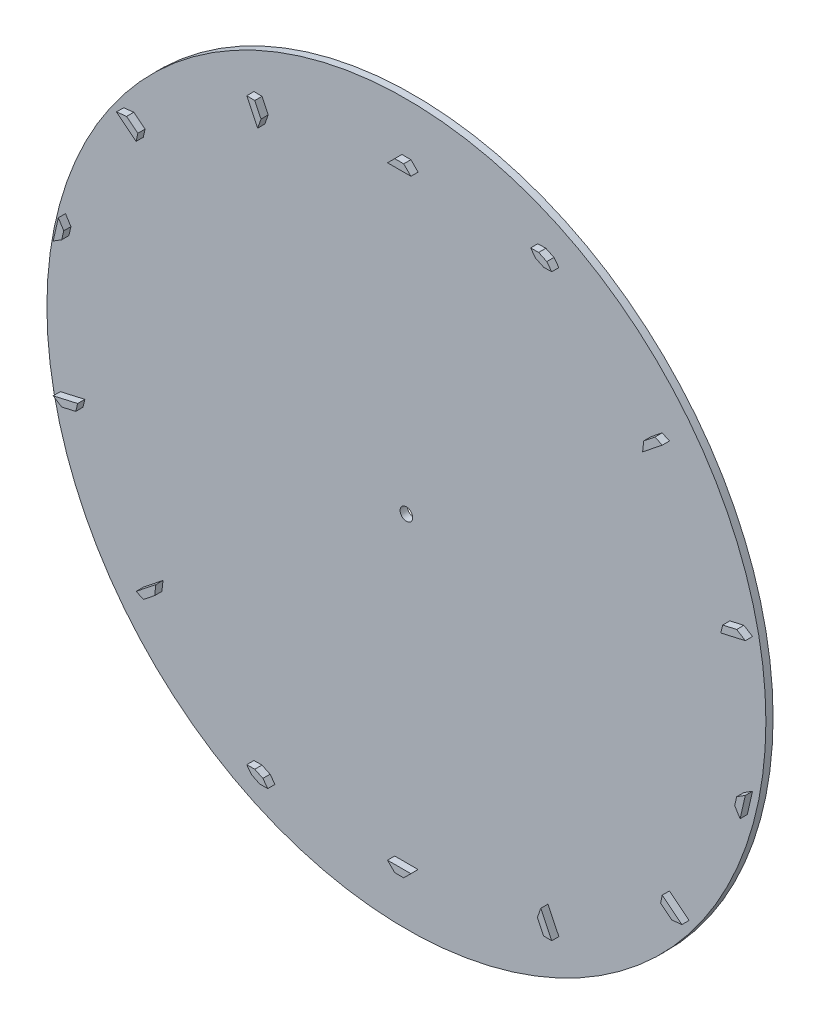
from build123d import *

# Parameters (mm, degrees)
SKETCH1_R           = 100
SKETCH1_R_2         = 1.75
BOSS_EXTRUDE1_DEPTH = 2
BOSS_EXTRUDE2_DEPTH = 2


with BuildPart() as part:
    # Sketch1 → Boss-Extrude1 (new body)
    with BuildSketch(Plane.XY):
        Circle(SKETCH1_R)
        Circle(SKETCH1_R_2, mode=Mode.SUBTRACT)
    extrude(amount=BOSS_EXTRUDE1_DEPTH)

    # Sketch2 → Boss-Extrude2 (add)
    with BuildSketch(Plane.XY.offset(2)):
        Polygon((-3.25, -84), (-1.25, -86), (1.25, -86), (3.25, -84), align=None)
        Polygon((-40.175747605, -80.544843437), (-42.41156908, -80.578044827), (-41.043515084, -82.346781173), (-38.791092914, -83.431490521), (-36.555271439, -83.398289131), (-37.923325436, -81.629552785), align=None)
        Polygon((-68.016869745, -52.642833607), (-67.700186383, -49.832191038), (-73.173006761, -54.196619651), (-71.144195674, -55.136792814), align=None)
        Polygon((-89.971519088, -19.253266034), (-89.441633044, -17.080889275), (-96.266128429, -18.638535813), (-93.871230737, -20.14334977), align=None)
        Polygon((-93.314928402, 22.58066955), (-94.819742358, 24.975567242), (-96.266128429, 18.638535813), (-93.871230737, 20.14334977), align=None)
        Polygon((-78.645827138, 58.561048264), (-73.173006761, 54.196619651), (-72.707858639, 56.383772418), (-75.835184569, 58.877731625), align=None)
        Polygon((-42.41156908, 80.578044827), (-39.374382907, 74.271262752), (-38.440212649, 76.940967966), (-40.175747605, 80.544843437), align=None)
        Polygon((-3.25, 84), (3.25, 84), (1.25, 86), (-1.25, 86), align=None)
        Polygon((40.175747605, 80.544843437), (42.41156908, 80.578044827), (41.043515084, 82.346781173), (38.791092914, 83.431490521), (36.555271439, 83.398289131), (37.923325436, 81.629552785), align=None)
        Polygon((68.016869745, 52.642833607), (67.700186383, 49.832191038), (73.173006761, 54.196619651), (71.144195674, 55.136792814), align=None)
        Polygon((89.971519088, 19.253266034), (89.441633044, 17.080889275), (96.266128429, 18.638535813), (93.871230737, 20.14334977), align=None)
        Polygon((93.314928402, -22.58066955), (94.819742358, -24.975567242), (96.266128429, -18.638535813), (93.871230737, -20.14334977), align=None)
        Polygon((78.645827138, -58.561048264), (73.173006761, -54.196619651), (72.707858639, -56.383772418), (75.835184569, -58.877731625), align=None)
        Polygon((42.41156908, -80.578044827), (39.374382907, -74.271262752), (38.440212649, -76.940967966), (40.175747605, -80.544843437), align=None)
    extrude(amount=BOSS_EXTRUDE2_DEPTH)


solid = part.part
